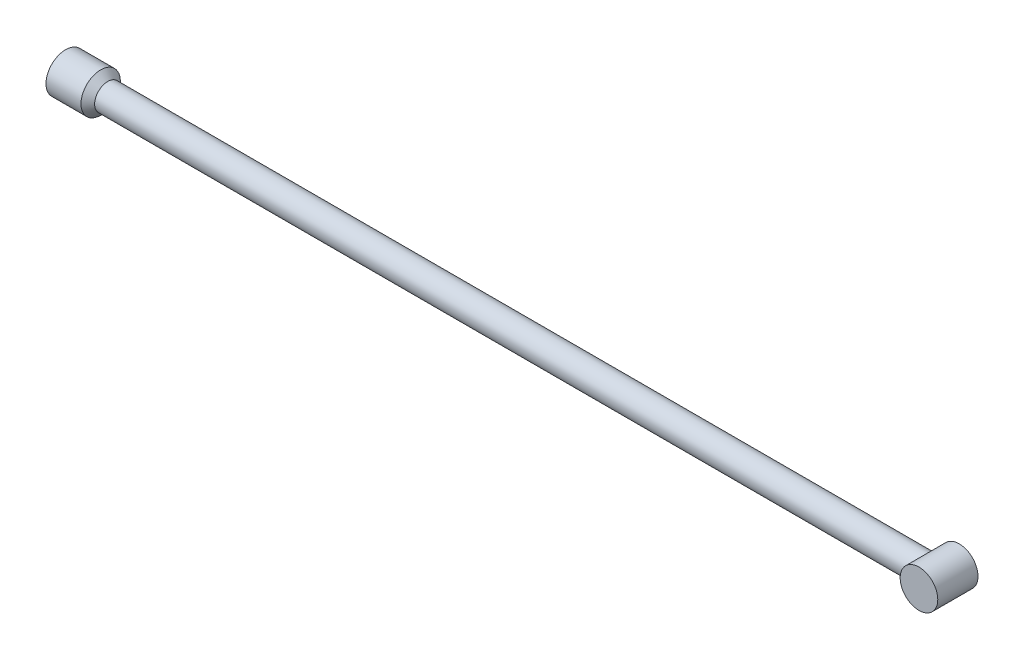
from build123d import *

# Parameters (mm, degrees)
SKETCH2_R                 = 75
SKETCH2_R_2               = 37.5
BOSS_EXTRUDE1_DEPTH       = 4750
SKETCH3_R                 = 112.5
SKETCH3_R_2               = 92.5
BOSS_EXTRUDE2_DEPTH       = 200
BOSS_EXTRUDE9_START       = -112.5
SKETCH4_R                 = 107.5
SKETCH4_R_2               = 92.5
BOSS_EXTRUDE9_DEPTH       = 225
SKETCH5_R                 = 75
CUT_EXTRUDE1_DEPTH        = 175
SKETCH6_R                 = 37.5
CUT_EXTRUDE2_DEPTH        = 4787
BOSS_EXTRUDE10_DEPTH      = 5
BOSS_EXTRUDE10_DEPTH_BACK = 5
SKETCH9_R                 = 107.5
SKETCH10_R                = 91.240764837
CUT_EXTRUDE3_DEPTH        = 181


with BuildPart() as part:
    # Sketch2 → Boss-Extrude1 (new body)
    with BuildSketch(Plane(origin=(0, 0, 0), x_dir=(0, 0, -1), z_dir=(1, 0, 0))):
        Circle(SKETCH2_R)
        Circle(SKETCH2_R_2, mode=Mode.SUBTRACT)
    extrude(amount=BOSS_EXTRUDE1_DEPTH)

    # Sketch5 → Cut-Extrude1 (cut)
    with BuildSketch(Plane.XY.offset(112.5)):
        with Locations((4795.79624469, 0)):
            Circle(SKETCH5_R)
    extrude(amount=-CUT_EXTRUDE1_DEPTH, mode=Mode.SUBTRACT)



with BuildPart() as body_2:
    # Sketch3 → Boss-Extrude2 (new body)
    with BuildSketch(Plane.ZY):
        Circle(SKETCH3_R)
        Circle(SKETCH3_R_2, mode=Mode.SUBTRACT)
    extrude(amount=BOSS_EXTRUDE2_DEPTH)


with BuildPart() as body_3:
    # Sketch4 → Boss-Extrude9 (new body)
    with BuildSketch(Plane.XY.offset(BOSS_EXTRUDE9_START)):
        with Locations((4795.79624469, 0)):
            Circle(SKETCH4_R)
        with Locations((4795.79624469, 0)):
            Circle(SKETCH4_R_2, mode=Mode.SUBTRACT)
    extrude(amount=BOSS_EXTRUDE9_DEPTH)

    # Sketch6 → Cut-Extrude2 (cut)
    with BuildSketch(Plane.ZY):
        Circle(SKETCH6_R)
    extrude(amount=-CUT_EXTRUDE2_DEPTH, mode=Mode.SUBTRACT)



with BuildPart() as part_1:
    add(part.part)

    add(body_2.part)  # Revolve1 merges body 2
    # Sketch7 → Revolve1 (revolve)
    with BuildSketch(Plane.XY, mode=Mode.PRIVATE) as revolve1_sk:
        Polygon((0, 112.5), (0, 75), (40.436119425, 75), align=None)
    revolve(revolve1_sk.sketch.rotate(Axis((-224.79445864, 0, 0), (1, 0, 0)), 90), axis=Axis((-224.79445864, 0, 0), (1, 0, 0)))


with BuildPart() as body_3_1:
    add(body_3.part)

    add(part_1.part)  # Boss-Extrude10 merges part
    # Sketch9 → Boss-Extrude10 (add, two sides: drawn at the far end of the back side and taken through both)
    with BuildSketch(Plane.XY.offset(112.5).offset(-BOSS_EXTRUDE10_DEPTH_BACK)):
        with Locations((4795.79624469, 0)):
            Circle(SKETCH9_R)
    extrude(amount=BOSS_EXTRUDE10_DEPTH + BOSS_EXTRUDE10_DEPTH_BACK)

    # Sketch10 → Cut-Extrude3 (cut)
    with BuildSketch(Plane(origin=(0, 0, -112.5), x_dir=(-1, 0, 0), z_dir=(0, 0, -1))):
        with Locations((-4797.389475289, 0)):
            Circle(SKETCH10_R)
    extrude(amount=-CUT_EXTRUDE3_DEPTH, mode=Mode.SUBTRACT)


solid = body_3_1.part
